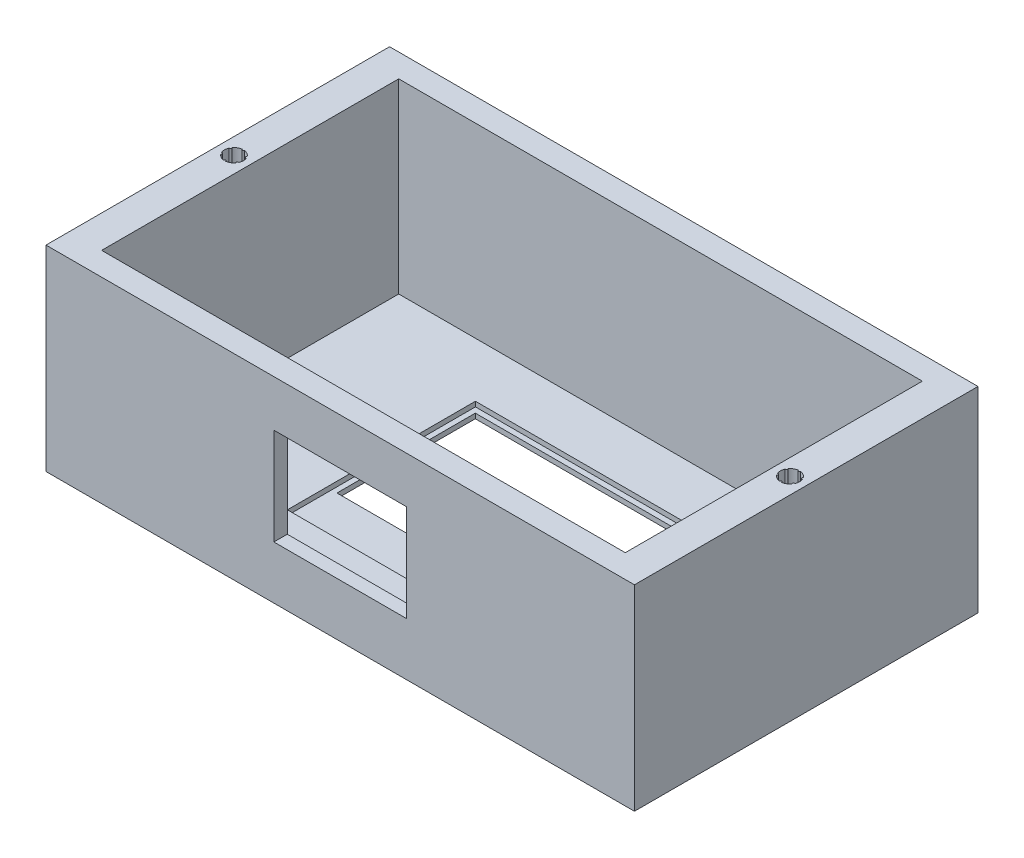
from build123d import *

# Parameters (mm, degrees)
SKETCH1_W           = 60.000499048
SKETCH1_H           = 35.031496816
BOSS_EXTRUDE1_DEPTH = 20
SKETCH2_W           = 53.393284908
SKETCH2_H           = 30.292765524
CUT_EXTRUDE1_DEPTH  = 19
SKETCH3_W           = 26.632310578
SKETCH3_H           = 19.17374817
CUT_EXTRUDE2_DEPTH  = 0.5
CUT_EXTRUDE3_DEPTH  = 0.5
SKETCH7_R           = 0.969129223
SKETCH7_R_2         = 0.961352825
CUT_EXTRUDE6_DEPTH  = 5
SKETCH8_R           = 0.104594239
BOSS_EXTRUDE2_DEPTH = 4
SKETCH9_R           = 0.799775616
CUT_EXTRUDE7_DEPTH  = 6
SKETCH10_R          = 1.291760959
CUT_EXTRUDE8_DEPTH  = 0.5
SKETCH13_W          = 13.531174942
SKETCH13_H          = 9.874100633
CUT_EXTRUDE11_DEPTH = 10
SKETCH14_W          = 20.49935166
SKETCH14_H          = 15.002696216
CUT_EXTRUDE12_DEPTH = 1


with BuildPart() as part:
    # Sketch1 → Boss-Extrude1 (new body)
    with BuildSketch(Plane(origin=(0, 0, 0), x_dir=(1, 0, 0), z_dir=(0, 1, 0))):
        Rectangle(SKETCH1_W, SKETCH1_H)
    extrude(amount=BOSS_EXTRUDE1_DEPTH)

    # Sketch2 → Cut-Extrude1 (cut)
    with BuildSketch(Plane(origin=(0, 20, 0), x_dir=(1, 0, 0), z_dir=(0, 1, 0))):
        Rectangle(SKETCH2_W, SKETCH2_H)
    extrude(amount=-CUT_EXTRUDE1_DEPTH, mode=Mode.SUBTRACT)

    # Sketch3 → Cut-Extrude2 (cut)
    with BuildSketch(Plane(origin=(0, 1, 0), x_dir=(1, 0, 0), z_dir=(0, 1, 0))):
        Rectangle(SKETCH3_W, SKETCH3_H)
    extrude(amount=-CUT_EXTRUDE2_DEPTH, mode=Mode.SUBTRACT)

    # Sketch4 → Cut-Extrude3 (cut)
    with BuildSketch(Plane(origin=(0, 0.5, 0), x_dir=(1, 0, 0), z_dir=(0, 1, 0))):
        Polygon((0, -5.07722156), (-12.772700857, -5.07722156), (-12.772700857, 9.032439271), (0, 9.032439271), (12.765065903, 9.032439271), (12.765065903, -5.07722156), align=None)
    extrude(amount=-CUT_EXTRUDE3_DEPTH, mode=Mode.SUBTRACT)

    # Sketch7 → Cut-Extrude6 (cut)
    with BuildSketch(Plane(origin=(0, 20, 0), x_dir=(1, 0, 0), z_dir=(0, 1, 0))):
        with Locations(Location((28.348445989, 0, 0), (0, 0, 270))):
            Circle(SKETCH7_R)
        with Locations(Location((-28.348445989, 0, 0), (0, 0, 270))):
            Circle(SKETCH7_R_2)
    extrude(amount=-CUT_EXTRUDE6_DEPTH, mode=Mode.SUBTRACT)

    # Sketch8 → Boss-Extrude2 (add)
    with BuildSketch(Plane(origin=(0, 20, 0), x_dir=(1, 0, 0), z_dir=(0, 1, 0))):
        with Locations((-28.348445989, 0.961352825)):
            Circle(SKETCH8_R)
        with Locations((-27.51589002, 0.480676413)):
            Circle(SKETCH8_R)
        with Locations((-27.51589002, -0.480676413)):
            Circle(SKETCH8_R)
        with Locations((-28.348445989, -0.961352825)):
            Circle(SKETCH8_R)
        with Locations((-29.181001958, -0.480676413)):
            Circle(SKETCH8_R)
        with Locations((-29.181001958, 0.480676413)):
            Circle(SKETCH8_R)
        with Locations((27.51589002, 0.480676413)):
            Circle(SKETCH8_R)
        with Locations((27.51589002, -0.480676413)):
            Circle(SKETCH8_R)
        with Locations((28.348445989, -0.961352825)):
            Circle(SKETCH8_R)
        with Locations((29.181001958, -0.480676413)):
            Circle(SKETCH8_R)
        with Locations((29.181001958, 0.480676413)):
            Circle(SKETCH8_R)
        with Locations((28.348445989, 0.961352825)):
            Circle(SKETCH8_R)
    extrude(amount=-BOSS_EXTRUDE2_DEPTH)

    # Sketch9 → Cut-Extrude7 (cut)
    with BuildSketch(Plane.XZ):
        with Locations(Location((-21.38647519, 0, 0), (0, 0, 270))):
            Circle(SKETCH9_R)
    extrude(amount=-CUT_EXTRUDE7_DEPTH, mode=Mode.SUBTRACT)

    # Sketch10 → Cut-Extrude8 (cut)
    with BuildSketch(Plane(origin=(0, 1, 0), x_dir=(1, 0, 0), z_dir=(0, 1, 0))):
        with Locations(Location((-21.38647519, 0, 0), (0, 0, 270))):
            Circle(SKETCH10_R)
    extrude(amount=-CUT_EXTRUDE8_DEPTH, mode=Mode.SUBTRACT)

    # Sketch13 → Cut-Extrude11 (cut)
    with BuildSketch(Plane.XY.offset(17.515748408)):
        with Locations((0, 10.335231811)):
            Rectangle(SKETCH13_W, SKETCH13_H)
    extrude(amount=-CUT_EXTRUDE11_DEPTH, mode=Mode.SUBTRACT)

    # Sketch14 → Cut-Extrude12 (cut)
    with BuildSketch(Plane(origin=(0, 0, 15.146382762), x_dir=(-1, 0, 0), z_dir=(0, 0, -1))):
        with Locations((0, 10.335231812)):
            Rectangle(SKETCH14_W, SKETCH14_H)
    extrude(amount=-CUT_EXTRUDE12_DEPTH, mode=Mode.SUBTRACT)


solid = part.part
